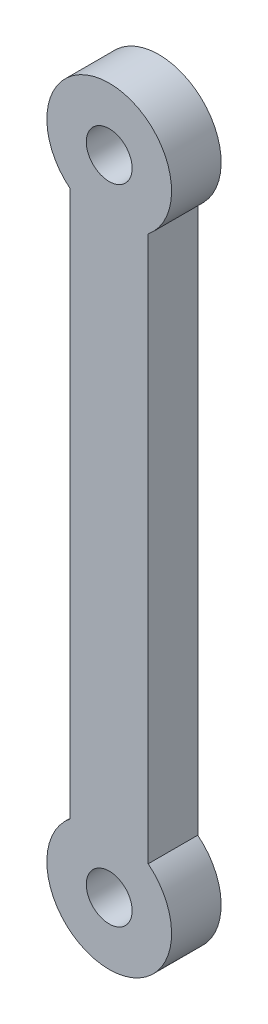
from build123d import *

# Parameters (mm, degrees)
BOSS_EXTRUDE1_DEPTH = 3.18
SKETCH2_R           = 1.47
CUT_EXTRUDE1_DEPTH  = 46.532650306


with BuildPart() as part:
    # Sketch1 → Boss-Extrude1 (new body)
    with BuildSketch(Plane.XY):
        with BuildLine():
            Line((-2.5, 3.122498999), (-2.5, 38.122498999))
            ThreePointArc((-2.5, 38.122498999), (0, 45.244997998), (2.5, 38.122498999))
            Line((2.5, 38.122498999), (2.5, 3.122498999))
            ThreePointArc((2.5, 3.122498999), (3.097299084, -2.531153568), (-2.562053138, -3.071788358))
            ThreePointArc((-2.562053138, -3.071788358), (-3.951581273, -0.620488066), (-3.380220787, 2.138716304))
            ThreePointArc((-3.380220787, 2.138716304), (-2.98097404, 2.667169619), (-2.5, 3.122498999))
        make_face()
    extrude(amount=BOSS_EXTRUDE1_DEPTH)

    # Sketch2 → Cut-Extrude1 (cut, through all)
    with BuildSketch(Plane.XY.offset(3.18)):
        with Locations((0, 41.244997998)):
            Circle(SKETCH2_R)
        Circle(SKETCH2_R)
    extrude(amount=-CUT_EXTRUDE1_DEPTH, mode=Mode.SUBTRACT)


solid = part.part
